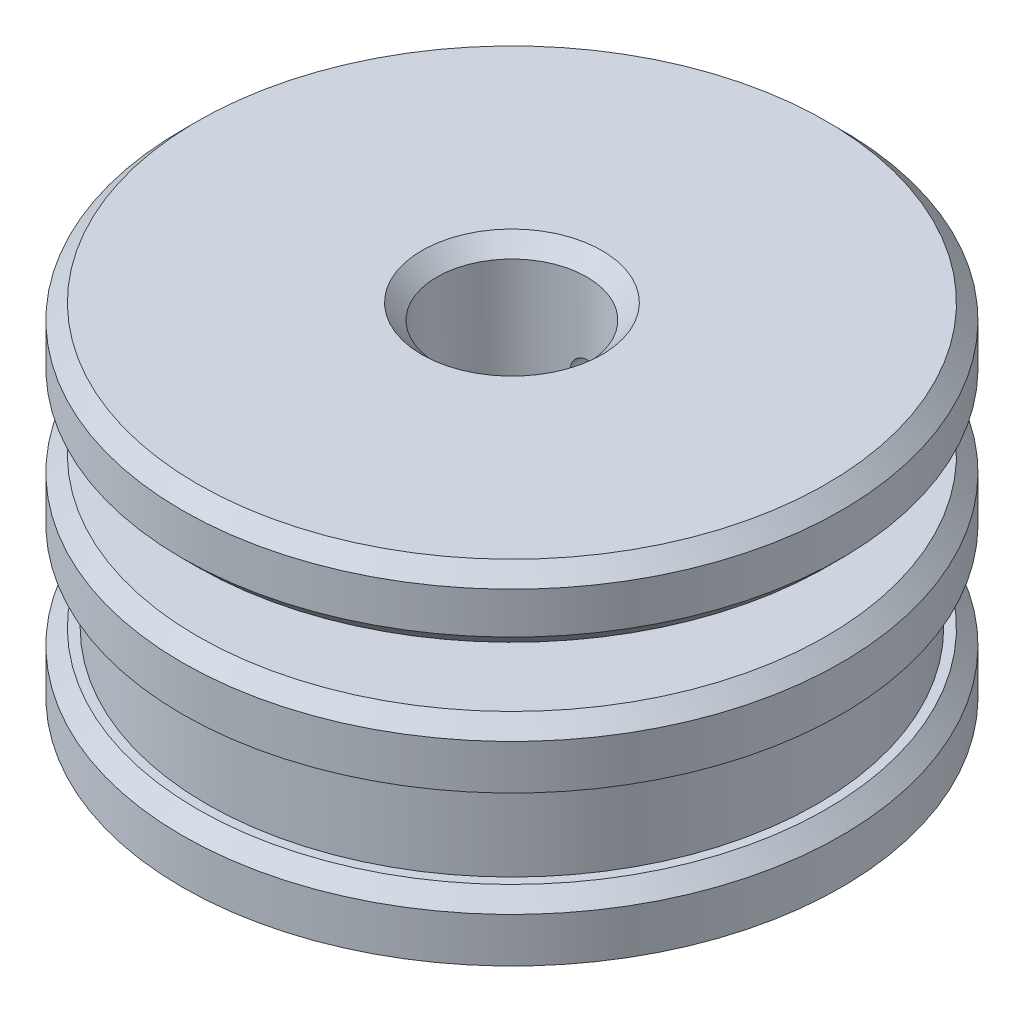
from build123d import *

# Parameters (mm, degrees)
SKETCH1_R           = 11
SKETCH1_R_2         = 2.38125
BOSS_EXTRUDE1_DEPTH = 2
SKETCH2_R           = 10.19
SKETCH2_R_2         = 1.1375
BOSS_EXTRUDE2_DEPTH = 1.5
SKETCH3_R           = 10.19
SKETCH3_R_2         = 2.5
BOSS_EXTRUDE3_DEPTH = 1.5
SKETCH5_R           = 11
SKETCH5_R_2         = 2.5
BOSS_EXTRUDE4_DEPTH = 2
SKETCH6_R           = 6.4
SKETCH6_R_2         = 2.5
BOSS_EXTRUDE5_DEPTH = 2
SKETCH7_R           = 11
SKETCH7_R_2         = 2.5
BOSS_EXTRUDE6_DEPTH = 2.4
SKETCH8_R           = 0.5
CUT_EXTRUDE1_DEPTH  = 20.286264542
CHAMFER1_SIZE       = 0.508


with BuildPart() as part:
    # Sketch1 → Boss-Extrude1 (new body)
    with BuildSketch(Plane(origin=(0, 0, 0), x_dir=(1, 0, 0), z_dir=(0, 1, 0))):
        with Locations(Location((0, 0, 0), (0, 0, 270))):
            Circle(SKETCH1_R)
        with Locations(Location((0, 0, 0), (0, 0, 270))):
            Circle(SKETCH1_R_2, mode=Mode.SUBTRACT)
    extrude(amount=BOSS_EXTRUDE1_DEPTH)

    # Sketch2 → Boss-Extrude2 (add)
    with BuildSketch(Plane(origin=(0, 2, 0), x_dir=(1, 0, 0), z_dir=(0, 1, 0))):
        with Locations(Location((0, 0, 0), (0, 0, 270))):
            Circle(SKETCH2_R)
        with Locations(Location((0, 0, 0), (0, 0, 270))):
            Circle(SKETCH2_R_2, mode=Mode.SUBTRACT)
    extrude(amount=BOSS_EXTRUDE2_DEPTH)

    # Sketch3 → Boss-Extrude3 (add)
    with BuildSketch(Plane(origin=(0, 3.5, 0), x_dir=(1, 0, 0), z_dir=(0, 1, 0))):
        with Locations(Location((0, 0, 0), (0, 0, 270))):
            Circle(SKETCH3_R)
        with Locations(Location((0, 0, 0), (0, 0, 270))):
            Circle(SKETCH3_R_2, mode=Mode.SUBTRACT)
    extrude(amount=BOSS_EXTRUDE3_DEPTH)

    # Sketch5 → Boss-Extrude4 (add)
    with BuildSketch(Plane(origin=(0, 5, 0), x_dir=(1, 0, 0), z_dir=(0, 1, 0))):
        with Locations(Location((0, 0, 0), (0, 0, 270))):
            Circle(SKETCH5_R)
        with Locations(Location((0, 0, 0), (0, 0, 270))):
            Circle(SKETCH5_R_2, mode=Mode.SUBTRACT)
    extrude(amount=BOSS_EXTRUDE4_DEPTH)

    # Sketch6 → Boss-Extrude5 (add)
    with BuildSketch(Plane(origin=(0, 7, 0), x_dir=(1, 0, 0), z_dir=(0, 1, 0))):
        with Locations(Location((0, 0, 0), (0, 0, 270))):
            Circle(SKETCH6_R)
        with Locations(Location((0, 0, 0), (0, 0, 270))):
            Circle(SKETCH6_R_2, mode=Mode.SUBTRACT)
    extrude(amount=BOSS_EXTRUDE5_DEPTH)

    # Sketch7 → Boss-Extrude6 (add)
    with BuildSketch(Plane(origin=(0, 9, 0), x_dir=(1, 0, 0), z_dir=(0, 1, 0))):
        with Locations(Location((0, 0, 0), (0, 0, 270))):
            Circle(SKETCH7_R)
        with Locations(Location((0, 0, 0), (0, 0, 270))):
            Circle(SKETCH7_R_2, mode=Mode.SUBTRACT)
    extrude(amount=BOSS_EXTRUDE6_DEPTH)

    # Sketch8 → Cut-Extrude1 (cut, through all)
    with BuildSketch(Plane.XY):
        with Locations(Location((0, 8, 0), (0, 0, 90))):
            Circle(SKETCH8_R)
        with Locations(Location((0, 4, 0), (0, 0, 89.999999996))):
            Circle(SKETCH8_R)
    extrude(amount=-CUT_EXTRUDE1_DEPTH, mode=Mode.SUBTRACT)

    # Chamfer1
    chamfer1_edges = [part.edges().sort_by_distance(p)[0] for p in [
        (0, 7, -11),
        (0, 11.4, -11),
        (0, 9, -11),
        (0, 11.4, -2.5),
        (0, 2, -11),
    ]]
    chamfer(chamfer1_edges, length=CHAMFER1_SIZE)


solid = part.part
